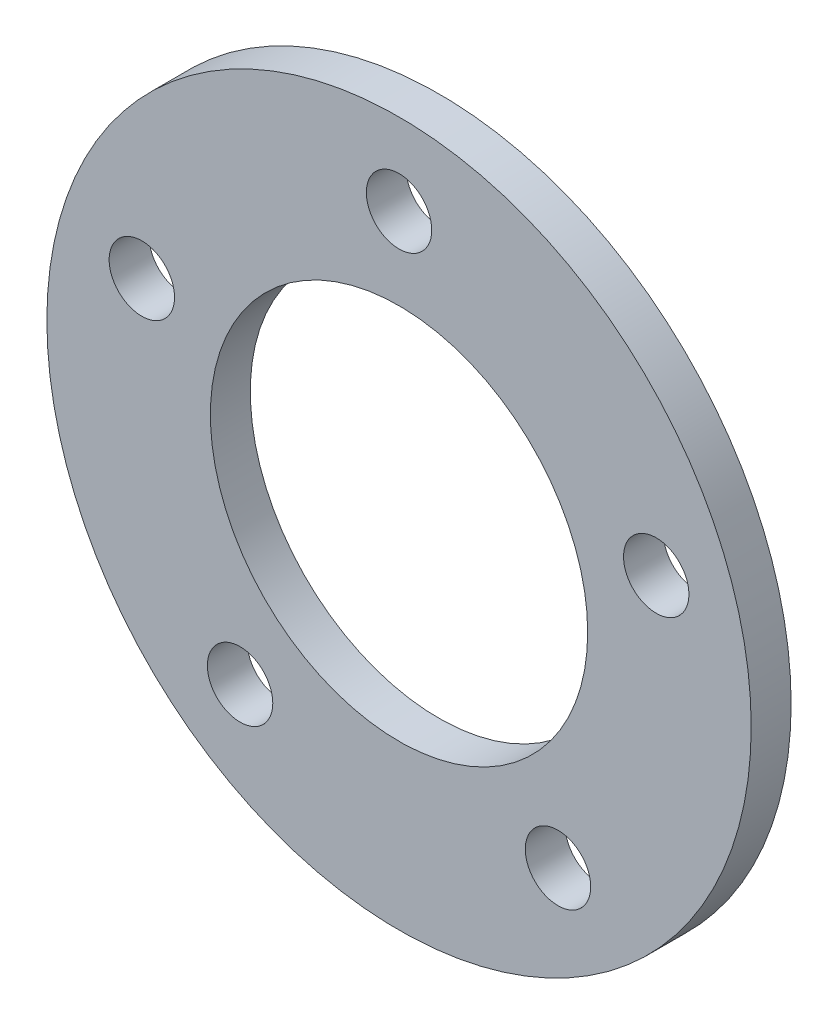
from build123d import *

# Parameters (mm, degrees)
SKETCH1_R           = 28
SKETCH1_R_2         = 15
SKETCH1_R_3         = 2.6
BOSS_EXTRUDE1_DEPTH = 3.175


with BuildPart() as part:
    # Sketch1 → Boss-Extrude1 (new body)
    with BuildSketch(Plane.XY):
        Circle(SKETCH1_R)
        Circle(SKETCH1_R_2, mode=Mode.SUBTRACT)
        with Locations((0, 21.5)):
            Circle(SKETCH1_R_3, mode=Mode.SUBTRACT)
        with Locations((20.4477151, 6.643865379)):
            Circle(SKETCH1_R_3, mode=Mode.SUBTRACT)
        with Locations((12.637382924, -17.393865379)):
            Circle(SKETCH1_R_3, mode=Mode.SUBTRACT)
        with Locations((-12.637382924, -17.393865379)):
            Circle(SKETCH1_R_3, mode=Mode.SUBTRACT)
        with Locations((-20.4477151, 6.643865379)):
            Circle(SKETCH1_R_3, mode=Mode.SUBTRACT)
    extrude(amount=BOSS_EXTRUDE1_DEPTH)


solid = part.part
